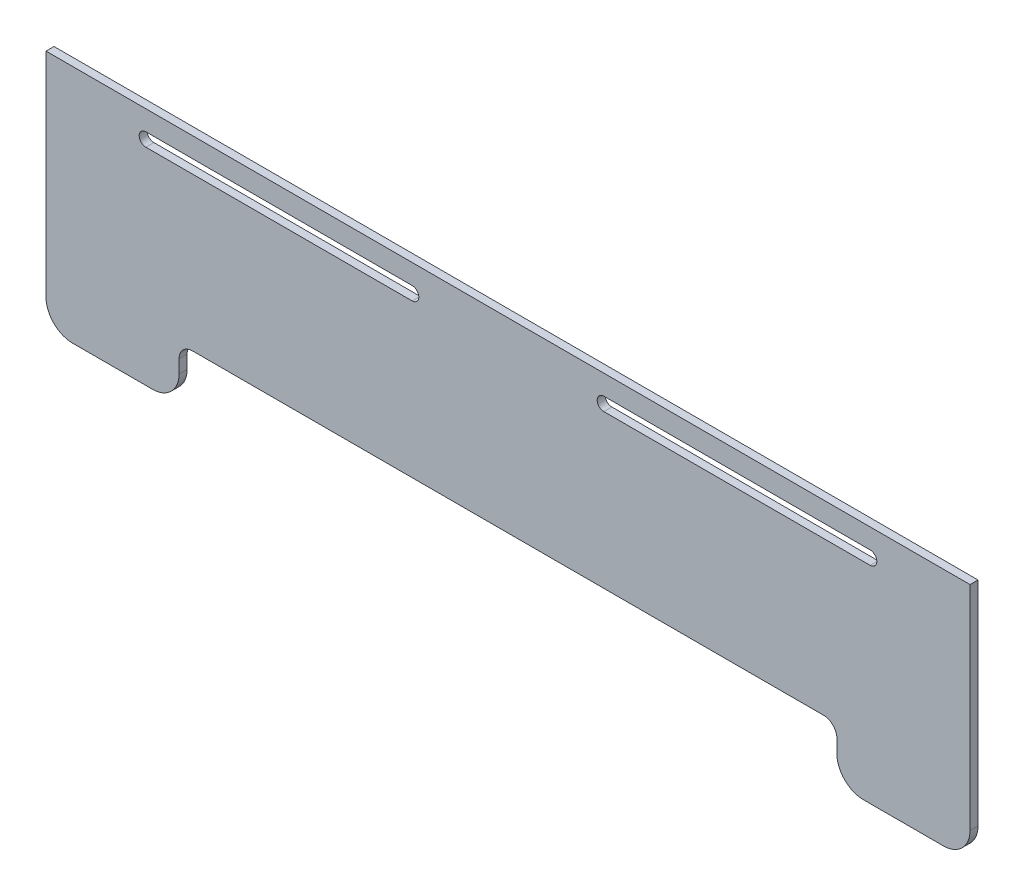
from build123d import *

# Parameters (mm, degrees)
BOSS_EXTRUDE1_DEPTH = 3


with BuildPart() as part:
    # Sketch1 → Boss-Extrude1 (new body)
    with BuildSketch(Plane.XY):
        with BuildLine():
            Line((-173.5, 0), (173.5, 0))
            Line((173.5, 0), (173.5, -80))
            ThreePointArc((173.5, -80), (170.571067812, -87.071067812), (163.5, -90))
            Line((163.5, -90), (133.5, -90))
            ThreePointArc((133.5, -90), (126.428932188, -87.071067812), (123.5, -80))
            Line((123.5, -80), (123.5, -75))
            ThreePointArc((123.5, -75), (122.035533906, -71.464466094), (118.5, -70))
            Line((118.5, -70), (-118.5, -70))
            ThreePointArc((-118.5, -70), (-122.035533906, -71.464466094), (-123.5, -75))
            Line((-123.5, -75), (-123.5, -80))
            ThreePointArc((-123.5, -80), (-126.428932188, -87.071067812), (-133.5, -90))
            Line((-133.5, -90), (-163.5, -90))
            ThreePointArc((-163.5, -90), (-170.571067812, -87.071067812), (-173.5, -80))
            Line((-173.5, -80), (-173.5, 0))
        make_face()
        with BuildLine():
            Line((36, -7.5), (136, -7.5))
            ThreePointArc((136, -7.5), (138.5, -10), (136, -12.5))
            Line((136, -12.5), (36, -12.5))
            ThreePointArc((36, -12.5), (33.5, -10), (36, -7.5))
        make_face(mode=Mode.SUBTRACT)
        with BuildLine():
            Line((-36, -7.5), (-136, -7.5))
            ThreePointArc((-136, -7.5), (-138.5, -10), (-136, -12.5))
            Line((-136, -12.5), (-36, -12.5))
            ThreePointArc((-36, -12.5), (-33.5, -10), (-36, -7.5))
        make_face(mode=Mode.SUBTRACT)
    extrude(amount=BOSS_EXTRUDE1_DEPTH)


solid = part.part
